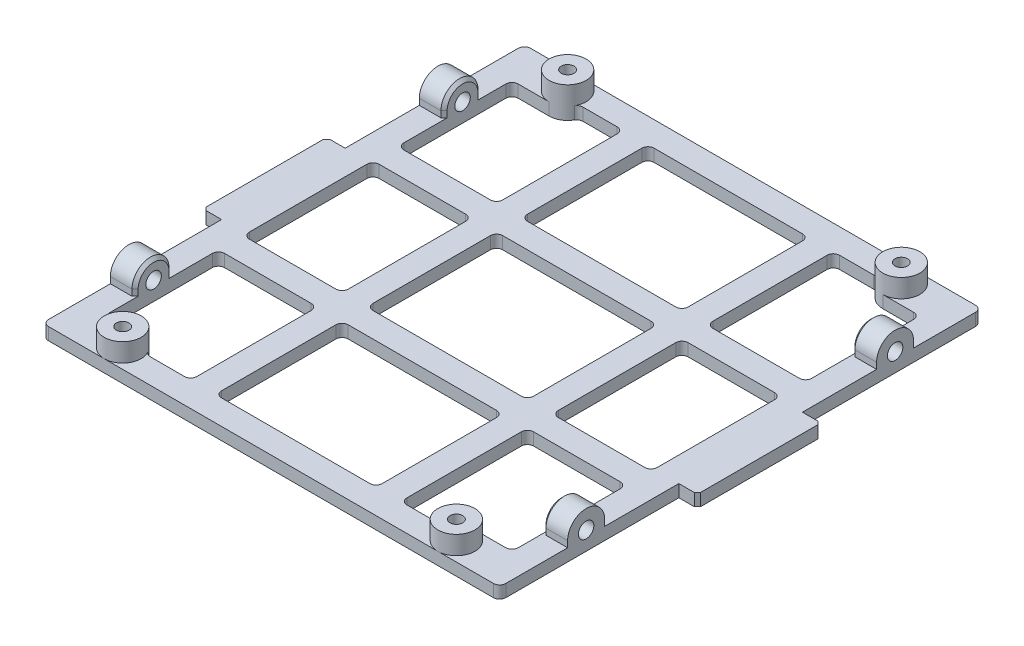
from build123d import *
from build123d.topology import SkipClean

# Parameters (mm, degrees)
EXTRUDE_1_DEPTH          = 39
SKETCH_2_W               = 3
SKETCH_2_H               = 29
CUT_EXTRUDE_1_DEPTH      = 57.00892786
CUT_EXTRUDE_2_DEPTH      = 57.187187152
CUT_EXTRUDE_2_DEPTH_BACK = 57.187187152
EXTRUDE_START            = 3
SKETCH_4_R               = 3
EXTRUDE_2_DEPTH          = 3
HOLE_WIZARD_M3_1_REACH   = 88.522
HOLE_WIZARD_M3_1_BORE_R  = 1.25
HOLE_WIZARD_M2_5_1_D     = 2.05
CHAMFER_1_SIZE           = 0.5
SKETCH_10_W              = 4
SKETCH_10_H              = 70
SKETCH_10_W_2            = 66
SKETCH_10_H_2            = 4
EXTRUDE_1_2_DEPTH        = 2
FILLET_1_R               = 1


with BuildPart() as part:
    # 草图1 → Extrude 1 (new, symmetric)
    with BuildSketch(Plane.XY):
        Polygon((-40, 0), (-40, 2), (-37, 2), (-37, 6), (-33, 6), (-33, 2), (33, 2), (33, 6), (37, 6), (37, 2), (40, 2), (40, 0), align=None)
    extrude(amount=EXTRUDE_1_DEPTH, both=True)

    # 草图2 → 切除-拉伸1 (cut, through all)
    with BuildSketch(Plane(origin=(0, 2, 0), x_dir=(1, 0, 0), z_dir=(0, 1, 0))):
        with Locations((-38.5, 24.5)):
            Rectangle(SKETCH_2_W, SKETCH_2_H)
        with BuildLine():
            Line((-24.171572875, -35), (24.171572875, -35))
            ThreePointArc((24.171572875, -35), (25.267949192, -33.550510257), (27, -33))
            Line((27, -33), (33, -33))
            Line((33, -33), (33, 33))
            Line((33, 33), (27, 33))
            ThreePointArc((27, 33), (25.267949192, 33.550510257), (24.171572875, 35))
            Line((24.171572875, 35), (-24.171572875, 35))
            ThreePointArc((-24.171572875, 35), (-25.267949192, 33.550510257), (-27, 33))
            Line((-27, 33), (-33, 33))
            Line((-33, 33), (-33, -33))
            Line((-33, -33), (-27, -33))
            ThreePointArc((-27, -33), (-25.267949192, -33.550510257), (-24.171572875, -35))
        make_face()
        with Locations((-38.5, -24.5)):
            Rectangle(SKETCH_2_W, SKETCH_2_H)
        with Locations((38.5, -24.5)):
            Rectangle(SKETCH_2_W, SKETCH_2_H)
        with Locations((38.5, 24.5)):
            Rectangle(SKETCH_2_W, SKETCH_2_H)
    extrude(amount=-CUT_EXTRUDE_1_DEPTH, mode=Mode.SUBTRACT)

    # 草图3 → 切除-拉伸2 (cut, two sides: drawn at the far end of the back side and taken through both)
    with BuildSketch(Plane(origin=(0, 0, 0), x_dir=(0, 0, -1), z_dir=(1, 0, 0)).offset(-CUT_EXTRUDE_2_DEPTH_BACK)):
        with BuildLine():
            Line((-22, 2), (22, 2))
            Line((22, 2), (22, 3))
            ThreePointArc((22, 3), (25, 6), (28, 3))
            Line((28, 3), (28, 2))
            Line((28, 2), (39, 2))
            Line((39, 2), (39, 7))
            Line((39, 7), (-39, 7))
            Line((-39, 7), (-39, 2))
            Line((-39, 2), (-28, 2))
            Line((-28, 2), (-28, 3))
            ThreePointArc((-28, 3), (-25, 6), (-22, 3))
            Line((-22, 3), (-22, 2))
        make_face()
    extrude(amount=CUT_EXTRUDE_2_DEPTH + CUT_EXTRUDE_2_DEPTH_BACK, mode=Mode.SUBTRACT)

    # 草图4 → 凸台-拉伸2 (add)
    with SkipClean():  # the faces are left unmerged after this step: merging them gives an invalid solid
        with BuildSketch(Plane(origin=(0, 2, 0), x_dir=(1, 0, 0), z_dir=(0, 1, 0)).offset(EXTRUDE_START)):
            with Locations(Location((-27, 36, 0), (0, 0, 270))):
                Circle(SKETCH_4_R)
            with Locations(Location((-27, -36, 0), (0, 0, 90))):
                Circle(SKETCH_4_R)
            with Locations(Location((27, -36, 0), (0, 0, 270))):
                Circle(SKETCH_4_R)
            with Locations(Location((27, 36, 0), (0, 0, 90))):
                Circle(SKETCH_4_R)
        extrude(amount=-EXTRUDE_2_DEPTH)

    # M3 螺纹孔1 bore → M3 螺纹孔1 (cut, up to next)
    with BuildSketch(Plane.ZY.offset(37), mode=Mode.PRIVATE) as hole_wizard_m3_1_sk1:
        with Locations((-25, 3)):
            Circle(HOLE_WIZARD_M3_1_BORE_R)
    hole_wizard_m3_1_tool1 = extrude(hole_wizard_m3_1_sk1.sketch, amount=-HOLE_WIZARD_M3_1_REACH, mode=Mode.PRIVATE) & part.part
    # M3 螺纹孔1 bore → M3 螺纹孔1 (cut, up to next)
    with BuildSketch(Plane.ZY.offset(37), mode=Mode.PRIVATE) as hole_wizard_m3_1_sk2:
        with Locations((25, 3)):
            Circle(HOLE_WIZARD_M3_1_BORE_R)
    hole_wizard_m3_1_tool2 = extrude(hole_wizard_m3_1_sk2.sketch, amount=-HOLE_WIZARD_M3_1_REACH, mode=Mode.PRIVATE) & part.part
    hole_wizard_m3_1_1 = hole_wizard_m3_1_tool1.solids().sort_by_distance((-37, 3, -25))[0]
    add(hole_wizard_m3_1_1, mode=Mode.SUBTRACT)
    hole_wizard_m3_1_2 = hole_wizard_m3_1_tool2.solids().sort_by_distance((-37, 3, 25))[0]
    add(hole_wizard_m3_1_2, mode=Mode.SUBTRACT)
    hole_wizard_m3_1 = hole_wizard_m3_1_1 + hole_wizard_m3_1_2  # M3 螺纹孔1 as one shape, for the pattern or mirror that repeats it

    # M2.5 螺纹孔1 (through all)
    with Locations(Plane(origin=(0, 5, 0), x_dir=(1, 0, 0), z_dir=(0, 1, 0))):
        with Locations((-27, 36), (27, 36), (-27, -36), (27, -36)):
            Hole(HOLE_WIZARD_M2_5_1_D / 2)

    # 镜向1: M3 螺纹孔1 across plane
    add(hole_wizard_m3_1.mirror(Plane(origin=(0, 0, 0), x_dir=(0, 0, 1), z_dir=(1, 0, 0))), mode=Mode.SUBTRACT)

    # 倒角1
    chamfer_1_edges = [part.edges().sort_by_distance(p)[0] for p in [
        (33, 2.5, -28),
        (-33, 2.5, -28),
        (33, 6, -25),
        (-33, 6, -25),
        (33, 2.5, -22),
        (-33, 2.5, -22),
        (33, 2.5, 22),
        (-33, 2.5, 22),
        (33, 6, 25),
        (-33, 6, 25),
        (33, 2.5, 28),
        (-33, 2.5, 28),
        (40, 1, -10),
        (40, 1, 10),
        (-40, 1, -10),
        (-40, 1, 10),
    ]]
    chamfer(chamfer_1_edges, length=CHAMFER_1_SIZE)

    # 草图10 → Extrude 1 2 (add)
    with BuildSketch(Plane(origin=(0, 2, 0), x_dir=(1, 0, 0), z_dir=(0, 1, 0))):
        with Locations((-15, 0)):
            Rectangle(SKETCH_10_W, SKETCH_10_H)
        with Locations((0, 12.5)):
            Rectangle(SKETCH_10_W_2, SKETCH_10_H_2)
        with Locations((0, -12.5)):
            Rectangle(SKETCH_10_W_2, SKETCH_10_H_2)
        with Locations((15, 0)):
            Rectangle(SKETCH_10_W, SKETCH_10_H)
    extrude(amount=-EXTRUDE_1_2_DEPTH)

    # 圆角1
    fillet_1_edges = [part.edges().sort_by_distance(p)[0] for p in [
        (37, 1, 39),
        (-37, 1, -39),
        (-37, 1, 39),
        (37, 1, -39),
        (-13, 1, -35),
        (-13, 1, -10.5),
        (-17, 1, -14.5),
        (-17, 1, 10.5),
        (-13, 1, 35),
        (-13, 1, 14.5),
        (-17, 1, -35),
        (-17, 1, 35),
        (-33, 1, 14.5),
        (-33, 1, 10.5),
        (-17, 1, 14.5),
        (-33, 1, -10.5),
        (-17, 1, -10.5),
        (-33, 1, -14.5),
        (-13, 1, -14.5),
        (13, 1, -14.5),
        (-13, 1, 10.5),
        (13, 1, 10.5),
        (17, 1, -10.5),
        (33, 1, -10.5),
        (33, 1, -14.5),
        (13, 1, 14.5),
        (13, 1, 35),
        (17, 1, 35),
        (17, 1, 14.5),
        (33, 1, 14.5),
        (33, 1, 10.5),
        (13, 1, -10.5),
        (17, 1, 10.5),
        (17, 1, -14.5),
        (17, 1, -35),
        (13, 1, -35),
        (-24.171572875, 1, 35),
        (-33, 1, 33),
        (-33, 1, -33),
        (-24.171572875, 1, -35),
        (24.171572875, 1, -35),
        (33, 1, -33),
        (33, 1, 33),
        (24.171572875, 1, 35),
    ]]
    fillet(fillet_1_edges, radius=FILLET_1_R)


solid = part.part
